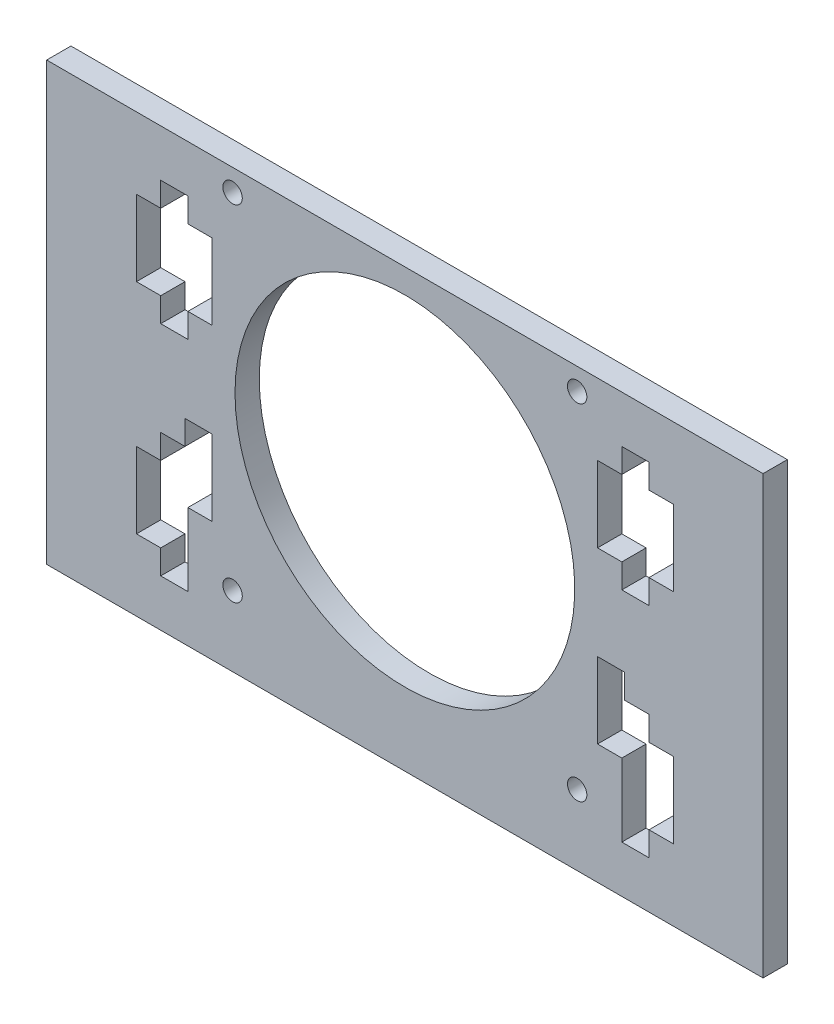
from build123d import *

# Parameters (mm, degrees)
SKETCH2_R           = 35
SKETCH2_R_2         = 2
BOSS_EXTRUDE1_DEPTH = 5


with BuildPart() as part:
    # Sketch2 → Boss-Extrude1 (new body)
    with BuildSketch(Plane(origin=(0, 0, 0), x_dir=(-1, 0, 0), z_dir=(0, 0, -1))):
        Polygon((-144.276672243, 28.966950724), (-144.276672243, -46.033049276), (-144.276672243, -61.033049276), (3.323327757, -61.033049276), (3.323327757, -46.033049276), (3.323327757, 28.966950724), align=None)
        with Locations((-70.476672243, -11.033049276)):
            Circle(SKETCH2_R, mode=Mode.SUBTRACT)
        with Locations((-34.976672243, 24.466950724)):
            Circle(SKETCH2_R_2, mode=Mode.SUBTRACT)
        with Locations((-105.976672243, 24.466950724)):
            Circle(SKETCH2_R_2, mode=Mode.SUBTRACT)
        with Locations((-105.976672243, -46.533049276)):
            Circle(SKETCH2_R_2, mode=Mode.SUBTRACT)
        with Locations((-34.976672243, -46.533049276)):
            Circle(SKETCH2_R_2, mode=Mode.SUBTRACT)
        Polygon((-30.776672243, 14.266950724), (-25.776672243, 14.266950724), (-25.776672243, 19.266950724), (-20.176672243, 19.266950724), (-20.176672243, 14.266950724), (-15.176672243, 14.266950724), (-15.176672243, -1.333049276), (-20.176672243, -1.333049276), (-20.176672243, -6.333049276), (-25.776672243, -6.333049276), (-25.776672243, -1.333049276), (-30.776672243, -1.333049276), align=None, mode=Mode.SUBTRACT)
        Polygon((-115.176672243, -6.333049276), (-115.176672243, -1.333049276), (-110.176672243, -1.333049276), (-110.176672243, 14.266950724), (-115.176672243, 14.266950724), (-115.176672243, 19.266950724), (-120.776672243, 19.266950724), (-120.776672243, 14.266950724), (-125.776672243, 14.266950724), (-125.776672243, -1.333049276), (-120.776672243, -1.333049276), (-120.776672243, -6.333049276), align=None, mode=Mode.SUBTRACT)
        Polygon((-120.776672243, -25.733049276), (-115.776672243, -25.733049276), (-115.776672243, -20.733049276), (-110.176672243, -20.733049276), (-110.176672243, -36.333049276), (-115.176672243, -36.333049276), (-115.176672243, -51.333049276), (-120.776672243, -51.333049276), (-120.776672243, -46.333049276), (-125.776672243, -46.333049276), (-125.776672243, -30.733049276), (-120.776672243, -30.733049276), align=None, mode=Mode.SUBTRACT)
        Polygon((-25.776672243, -36.333049276), (-25.776672243, -51.333049276), (-20.176672243, -51.333049276), (-20.176672243, -46.333049276), (-15.176672243, -46.333049276), (-15.176672243, -30.733049276), (-20.176672243, -30.733049276), (-20.176672243, -25.733049276), (-25.176672243, -25.733049276), (-25.176672243, -20.733049276), (-30.776672243, -20.733049276), (-30.776672243, -36.333049276), align=None, mode=Mode.SUBTRACT)
    extrude(amount=BOSS_EXTRUDE1_DEPTH)


solid = part.part
